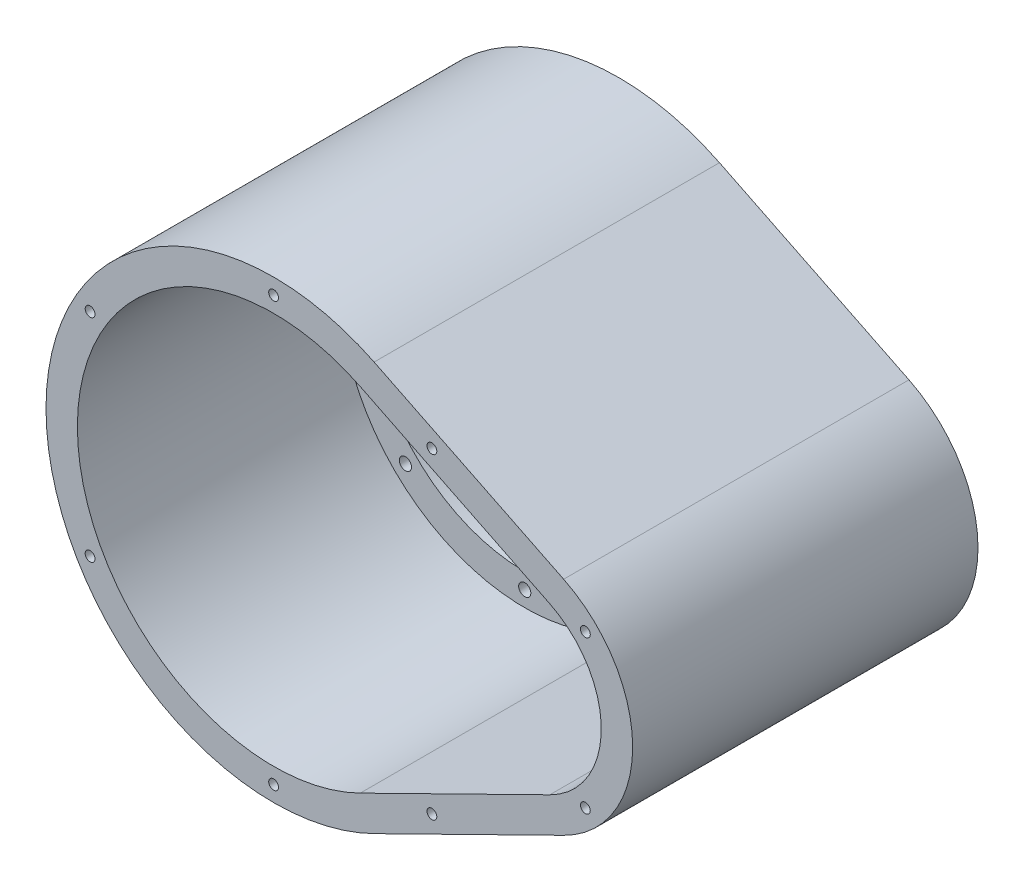
from build123d import *
from build123d.topology import SkipClean

# Parameters (mm, degrees)
SKETCH1_R           = 4
BOSS_EXTRUDE2_DEPTH = 8
BOSS_EXTRUDE3_DEPTH = 16
SKETCH6_R           = 1.55
CUT_EXTRUDE1_DEPTH  = 24
SKETCH7_R           = 8.2
CUT_EXTRUDE2_DEPTH  = 5
SKETCH8_R           = 2
BOSS_EXTRUDE4_DEPTH = 8.5
SKETCH9_R           = 3.5
CUT_EXTRUDE3_DEPTH  = 3
BOSS_EXTRUDE5_DEPTH = 80
SKETCH11_R          = 1.25
CUT_EXTRUDE4_DEPTH  = 10


with BuildPart() as part:
    # Sketch1 → Boss-Extrude2 (new body)
    with BuildSketch(Plane.XY):
        with BuildLine():
            Line((73.9125, 28.261145478), (25.616666667, 52.036394849))
            ThreePointArc((25.616666667, 52.036394849), (-58, 0), (25.616666667, -52.036394849))
            Line((25.616666667, -52.036394849), (73.9125, -28.261145478))
            ThreePointArc((73.9125, -28.261145478), (91.5, 0), (73.9125, 28.261145478))
        make_face()
        Circle(SKETCH1_R, mode=Mode.SUBTRACT)
    extrude(amount=BOSS_EXTRUDE2_DEPTH)

    # Sketch5 → Boss-Extrude3 (add)
    with BuildSketch(Plane.XY.offset(8)):
        with BuildLine():
            Line((20.758333333, 42.167423412), (69.054166667, 18.392174041))
            ThreePointArc((69.054166667, 18.392174041), (80.5, 0), (69.054166667, -18.392174041))
            Line((69.054166667, -18.392174041), (20.758333333, -42.167423412))
            ThreePointArc((20.758333333, -42.167423412), (-47, 0), (20.758333333, 42.167423412))
        make_face()
        with BuildLine():
            Line((65.520833333, 11.214740269), (17.225, 34.98998964))
            ThreePointArc((17.225, 34.98998964), (-39, 0), (17.225, -34.98998964))
            Line((17.225, -34.98998964), (65.520833333, -11.214740269))
            ThreePointArc((65.520833333, -11.214740269), (72.5, 0), (65.520833333, 11.214740269))
        make_face(mode=Mode.SUBTRACT)
    extrude(amount=BOSS_EXTRUDE3_DEPTH)

    # Sketch6 → Cut-Extrude1 (cut)
    with BuildSketch(Plane.XY.offset(24)):
        with Locations((0, 43)):
            Circle(SKETCH6_R)
        with Locations((-30.405591591, 30.405591591)):
            Circle(SKETCH6_R)
        with Locations((-43, 0)):
            Circle(SKETCH6_R)
        with Locations((-30.405591591, -30.405591591)):
            Circle(SKETCH6_R)
        with Locations((0, -43)):
            Circle(SKETCH6_R)
        with Locations((76.5, 0)):
            Circle(SKETCH6_R)
        with Locations((58.315707785, 19.220123822)):
            Circle(SKETCH6_R)
        with Locations((32.44935499, 31.953706526)):
            Circle(SKETCH6_R)
        with Locations((58.315707785, -19.220123822)):
            Circle(SKETCH6_R)
        with Locations((32.44935499, -31.953706526)):
            Circle(SKETCH6_R)
    extrude(amount=-CUT_EXTRUDE1_DEPTH, mode=Mode.SUBTRACT)

    # Sketch7 → Cut-Extrude2 (cut)
    with BuildSketch(Plane.XY.offset(8)):
        Circle(SKETCH7_R)
    extrude(amount=-CUT_EXTRUDE2_DEPTH, mode=Mode.SUBTRACT)

    # Sketch8 → Boss-Extrude4 (add)
    with BuildSketch(Plane.XY.offset(8)):
        with Locations(Location((60, 0, 0), (0, 0, 180))):
            Circle(SKETCH8_R)
    extrude(amount=BOSS_EXTRUDE4_DEPTH)

    # Sketch9 → Cut-Extrude3 (cut)
    with BuildSketch(Plane(origin=(0, 0, 0), x_dir=(-1, 0, 0), z_dir=(0, 0, -1))):
        with Locations((0, 43)):
            Circle(SKETCH9_R)
        with Locations((30.405591591, 30.405591591)):
            Circle(SKETCH9_R)
        with Locations((43, 0)):
            Circle(SKETCH9_R)
        with Locations((30.405591591, -30.405591591)):
            Circle(SKETCH9_R)
        with Locations((0, -43)):
            Circle(SKETCH9_R)
        with Locations((-32.44935499, 31.953706526)):
            Circle(SKETCH9_R)
        with Locations((-32.44935499, -31.953706526)):
            Circle(SKETCH9_R)
        with Locations((-58.315707785, -19.220123822)):
            Circle(SKETCH9_R)
        with Locations((-58.315707785, 19.220123822)):
            Circle(SKETCH9_R)
        with Locations((-76.5, 0)):
            Circle(SKETCH9_R)
    extrude(amount=-CUT_EXTRUDE3_DEPTH, mode=Mode.SUBTRACT)

    # Sketch10 → Boss-Extrude5 (add)
    with SkipClean():  # the faces are left unmerged after this step: merging them gives an invalid solid
        with BuildSketch(Plane.XY.offset(8)):
            with BuildLine():
                Line((25.616666667, 52.036394849), (73.9125, 28.261145478))
                ThreePointArc((73.9125, 28.261145478), (91.5, 0), (73.9125, -28.261145478))
                Line((73.9125, -28.261145478), (25.616666667, -52.036394849))
                ThreePointArc((25.616666667, -52.036394849), (-58, 0), (25.616666667, 52.036394849))
            make_face()
            with BuildLine():
                Line((22.083333333, 44.858961077), (70.379166667, 21.083711706))
                ThreePointArc((70.379166667, 21.083711706), (83.5, 0), (70.379166667, -21.083711706))
                Line((70.379166667, -21.083711706), (22.083333333, -44.858961077))
                ThreePointArc((22.083333333, -44.858961077), (-50, 0), (22.083333333, 44.858961077))
            make_face(mode=Mode.SUBTRACT)
        extrude(amount=BOSS_EXTRUDE5_DEPTH)

    # Sketch11 → Cut-Extrude4 (cut)
    with SkipClean():  # the faces are left unmerged after this step: merging them gives an invalid solid
        with BuildSketch(Plane.XY.offset(88)):
            with Locations((0, 54)):
                Circle(SKETCH11_R)
            with Locations((-46.765371804, 27)):
                Circle(SKETCH11_R)
            with Locations((-46.765371804, -27)):
                Circle(SKETCH11_R)
            with Locations((0, -54)):
                Circle(SKETCH11_R)
            with Locations((40.333245578, 40.333245578)):
                Circle(SKETCH11_R)
            with Locations((40.333245578, -40.333245578)):
                Circle(SKETCH11_R)
            with Locations((79.445436483, 19.445436483)):
                Circle(SKETCH11_R)
            with Locations((79.445436483, -19.445436483)):
                Circle(SKETCH11_R)
        extrude(amount=-CUT_EXTRUDE4_DEPTH, mode=Mode.SUBTRACT)


solid = part.part
